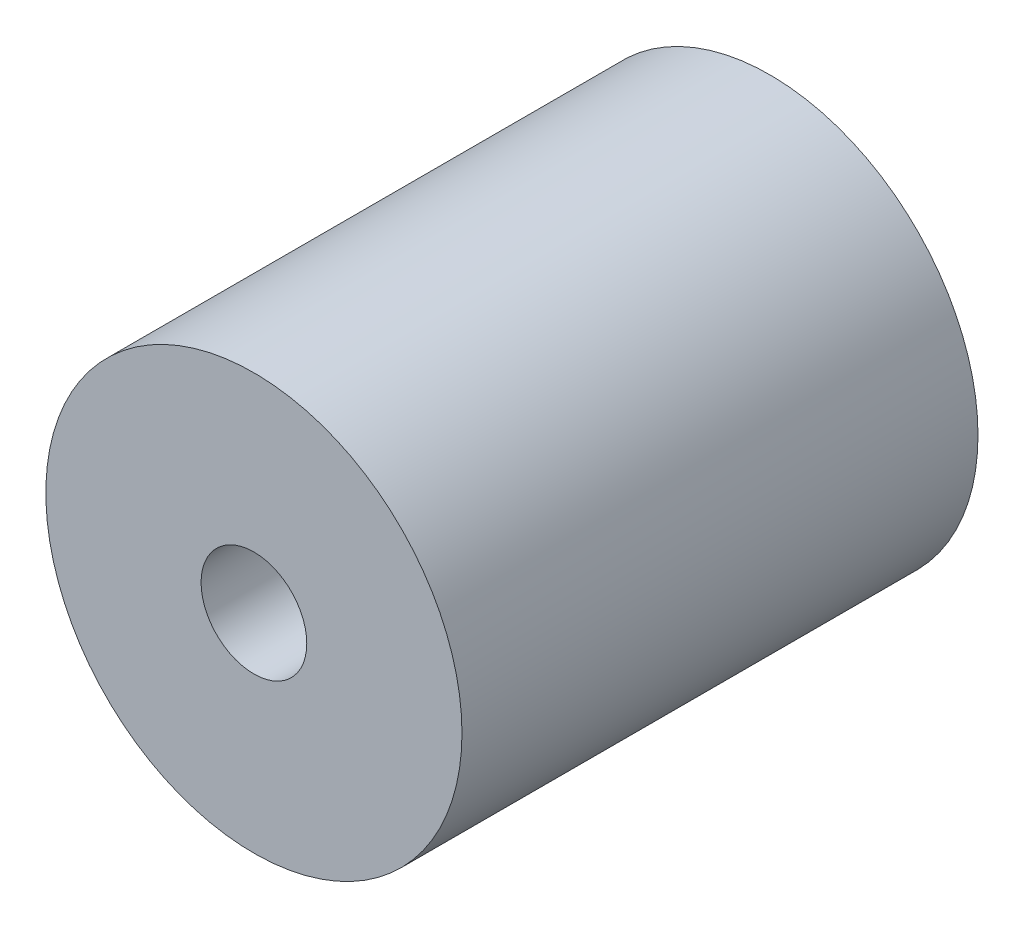
from build123d import *

# Parameters (mm, degrees)
SKETCH_1_R          = 12.5
SKETCH_1_R_2        = 3.175
EXTRUDE_1_DEPTH     = 31
SKETCH_3_R          = 5
CUT_EXTRUDE_1_DEPTH = 8


with BuildPart() as part:
    # 草图1 → 凸台-拉伸1 (new body)
    with BuildSketch(Plane.XY):
        Circle(SKETCH_1_R)
        Circle(SKETCH_1_R_2, mode=Mode.SUBTRACT)
    extrude(amount=EXTRUDE_1_DEPTH)

    # 草图3 → 切除-拉伸1 (cut)
    with BuildSketch(Plane(origin=(0, 0, 0), x_dir=(-1, 0, 0), z_dir=(0, 0, -1))):
        Circle(SKETCH_3_R)
    extrude(amount=-CUT_EXTRUDE_1_DEPTH, mode=Mode.SUBTRACT)


solid = part.part
